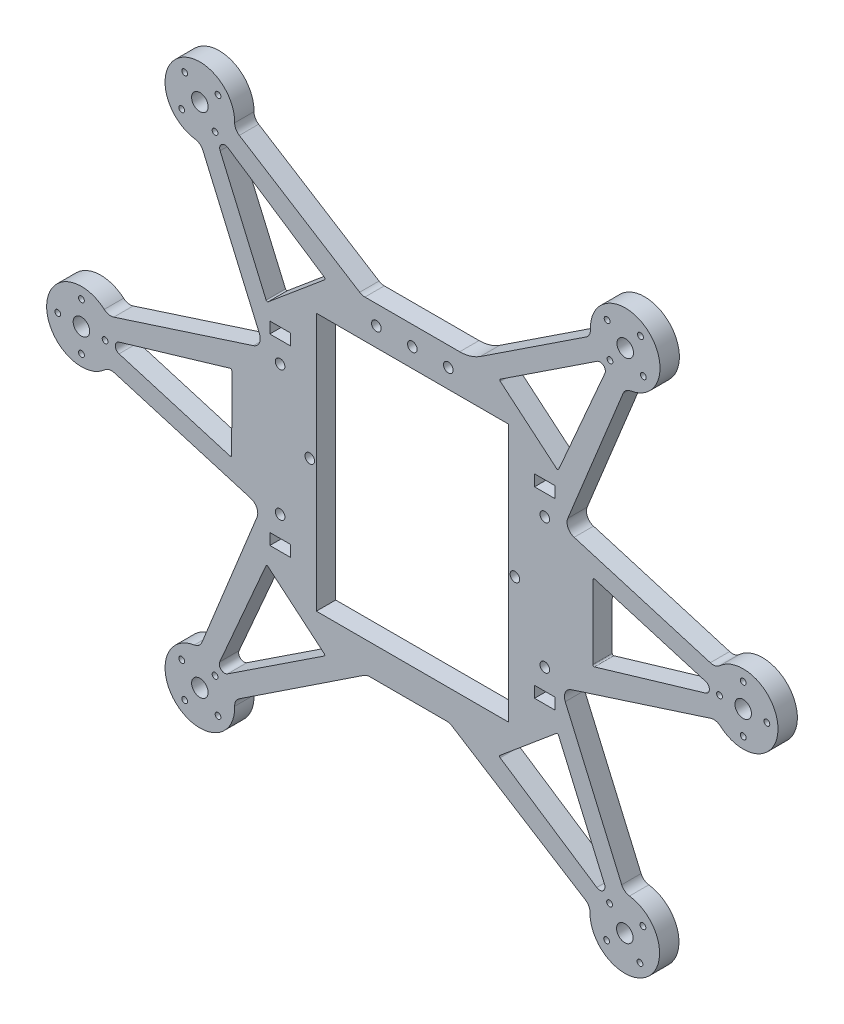
from build123d import *

# Parameters (mm, degrees)
SKETCH1_R           = 2.5
SKETCH1_R_2         = 0.875
SKETCH1_R_3         = 1.45
SKETCH1_R_4         = 1.450000004
SKETCH1_R_5         = 1.450000003
SKETCH1_W           = 6.2
SKETCH1_H           = 3.4
SKETCH1_W_2         = 58
SKETCH1_H_2         = 78
BOSS_EXTRUDE5_DEPTH = 5.85


with BuildPart() as part:
    # Sketch1 → Boss-Extrude5 (new body)
    with BuildSketch(Plane.XY):
        with BuildLine():
            Line((603.954941057, 476.522477238), (586.876874298, 515.94635583))
            ThreePointArc((586.876874298, 515.94635583), (585.936525014, 517.144467375), (584.529018435, 517.726406616))
            ThreePointArc((584.529018435, 517.726406616), (579.097676306, 536.134868239), (596.468420789, 527.972260032))
            ThreePointArc((596.468420789, 527.972260032), (596.82997325, 526.492730421), (597.871467664, 525.381417037))
            Line((597.871467664, 525.381417037), (634.246279226, 502.517129354))
            ThreePointArc((634.246279226, 502.517129354), (635.012052507, 502.174352645), (635.842799888, 502.057035213))
            Line((635.842799888, 502.057035213), (664.477624236, 502.057035213))
            ThreePointArc((664.477624236, 502.057035213), (667.733181619, 502.535188201), (670.713759981, 503.929260211))
            Line((670.713759981, 503.929260211), (702.648845813, 525.004026215))
            ThreePointArc((702.648845813, 525.004026215), (703.665465412, 526.138139367), (703.994152736, 527.625315447))
            ThreePointArc((703.994152736, 527.625315447), (721.1798058, 536.1707391), (716.157604078, 517.646473216))
            ThreePointArc((716.157604078, 517.646473216), (714.763334773, 517.033495929), (713.849758343, 515.814846612))
            Line((713.849758343, 515.814846612), (697.147626147, 474.790192689))
            ThreePointArc((697.147626147, 474.790192689), (697.221465914, 472.361081432), (699.070208039, 470.783682824))
            Line((699.070208039, 470.783682824), (740.214490272, 458.53510182))
            ThreePointArc((740.214490272, 458.53510182), (741.736741832, 458.485319907), (743.087260943, 459.189469167))
            ThreePointArc((743.087260943, 459.189469167), (760.6801601, 451.51738758), (743.261540117, 443.457448713))
            ThreePointArc((743.261540117, 443.457448713), (741.895753238, 444.131506761), (740.374978091, 444.048014227))
            Line((740.374978091, 444.048014227), (698.212346292, 430.47245055))
            ThreePointArc((698.212346292, 430.47245055), (696.399002399, 428.854483388), (696.378993493, 426.424332476))
            Line((696.378993493, 426.424332476), (713.443070907, 387.0327476))
            ThreePointArc((713.443070907, 387.0327476), (714.383420191, 385.834636055), (715.79092677, 385.252696814))
            ThreePointArc((715.79092677, 385.252696814), (721.222268899, 366.844235191), (703.851524416, 375.006843398))
            ThreePointArc((703.851524416, 375.006843398), (703.489971954, 376.486373008), (702.448477541, 377.597686392))
            Line((702.448477541, 377.597686392), (662.116784523, 402.949169804))
            ThreePointArc((662.116784523, 402.949169804), (661.351028594, 403.291941512), (660.520299977, 403.409263945))
            Line((660.520299977, 403.409263945), (637.239098686, 403.409544222))
            ThreePointArc((637.239098686, 403.409544222), (636.373912642, 403.282089365), (635.582244311, 402.910534677))
            Line((635.582244311, 402.910534677), (597.801874827, 377.882367998))
            ThreePointArc((597.801874827, 377.882367998), (596.787260959, 376.746460102), (596.461202206, 375.258705506))
            ThreePointArc((596.461202206, 375.258705506), (579.290676989, 366.682925635), (584.280135784, 385.216037558))
            ThreePointArc((584.280135784, 385.216037558), (585.673319691, 385.831477766), (586.584741163, 387.051739604))
            Line((586.584741163, 387.051739604), (603.228036217, 428.139630454))
            ThreePointArc((603.228036217, 428.139630454), (603.150479211, 430.567413415), (601.300918772, 432.141983635))
            Line((601.300918772, 432.141983635), (560.112090621, 444.364217596))
            ThreePointArc((560.112090621, 444.364217596), (558.589795669, 444.412654468), (557.239899253, 443.7073122))
            ThreePointArc((557.239899253, 443.7073122), (539.640228116, 451.363846175), (557.051719751, 459.439172525))
            ThreePointArc((557.051719751, 459.439172525), (558.418101677, 458.766321513), (559.938802458, 458.851157731))
            Line((559.938802458, 458.851157731), (602.124111054, 472.475172686))
            ThreePointArc((602.124111054, 472.475172686), (603.935478665, 474.093533762), (603.954941057, 476.522477238))
        make_face()
        with Locations((550.160251098, 451.489683338)):
            Circle(SKETCH1_R, mode=Mode.SUBTRACT)
        with Locations((714.50687282, 528.036940234)):
            Circle(SKETCH1_R, mode=Mode.SUBTRACT)
        with Locations((585.949161838, 528.150892754)):
            Circle(SKETCH1_R, mode=Mode.SUBTRACT)
        with Locations((719.982944906, 523.433718795)):
            Circle(SKETCH1_R_2, mode=Mode.SUBTRACT)
        with Locations((681.160212062, 451.489683338)):
            Circle(SKETCH1_R_3, mode=Mode.SUBTRACT)
        with Locations((550.160251098, 458.643494428)):
            Circle(SKETCH1_R_2, mode=Mode.SUBTRACT)
        with Locations((619.160212062, 451.489683338)):
            Circle(SKETCH1_R_3, mode=Mode.SUBTRACT)
        with Locations((557.314062187, 451.489683338)):
            Circle(SKETCH1_R_2, mode=Mode.SUBTRACT)
        with Locations((709.903651381, 522.560868149)):
            Circle(SKETCH1_R_2, mode=Mode.SUBTRACT)
        with Locations((709.030800734, 532.640161674)):
            Circle(SKETCH1_R_2, mode=Mode.SUBTRACT)
        with Locations((661.029382116, 496.222272015)):
            Circle(SKETCH1_R_3, mode=Mode.SUBTRACT)
        with Locations((719.110094259, 533.51301232)):
            Circle(SKETCH1_R_2, mode=Mode.SUBTRACT)
        with Locations((750.160030038, 451.400845678)):
            Circle(SKETCH1_R, mode=Mode.SUBTRACT)
        with Locations((750.153709121, 444.247037381)):
            Circle(SKETCH1_R_2, mode=Mode.SUBTRACT)
        with Locations((591.433359939, 532.744429986)):
            Circle(SKETCH1_R_2, mode=Mode.SUBTRACT)
        with Locations((590.54269907, 522.666694653)):
            Circle(SKETCH1_R_2, mode=Mode.SUBTRACT)
        with Locations((610.198620139, 432.360721889)):
            Circle(SKETCH1_R_4, mode=Mode.SUBTRACT)
        with Locations((690.19862014, 471.710721889)):
            Circle(SKETCH1_R_5, mode=Mode.SUBTRACT)
        with Locations((580.464963737, 523.557355522)):
            Circle(SKETCH1_R_2, mode=Mode.SUBTRACT)
        with Locations((581.355624606, 533.635090855)):
            Circle(SKETCH1_R_2, mode=Mode.SUBTRACT)
        with Locations((550.160251098, 444.335872249)):
            Circle(SKETCH1_R_2, mode=Mode.SUBTRACT)
        with Locations((543.006440008, 451.489683338)):
            Circle(SKETCH1_R_2, mode=Mode.SUBTRACT)
        with Locations((743.006221741, 451.407166596)):
            Circle(SKETCH1_R_2, mode=Mode.SUBTRACT)
        with Locations((750.166350956, 458.554653975)):
            Circle(SKETCH1_R_2, mode=Mode.SUBTRACT)
        with Locations((639.291042009, 496.222272015)):
            Circle(SKETCH1_R_3, mode=Mode.SUBTRACT)
        with Locations((585.949225938, 374.828503848)):
            Circle(SKETCH1_R, mode=Mode.SUBTRACT)
        with Locations((580.465027837, 379.422041079)):
            Circle(SKETCH1_R_2, mode=Mode.SUBTRACT)
        with Locations((590.54276317, 380.312701948)):
            Circle(SKETCH1_R_2, mode=Mode.SUBTRACT)
        with Locations((591.433424039, 370.234966616)):
            Circle(SKETCH1_R_2, mode=Mode.SUBTRACT)
        with Locations((581.355688706, 369.344305747)):
            Circle(SKETCH1_R_2, mode=Mode.SUBTRACT)
        with Locations((757.313838335, 451.394524761)):
            Circle(SKETCH1_R_2, mode=Mode.SUBTRACT)
        with Locations((714.370783367, 374.828210676)):
            Circle(SKETCH1_R, mode=Mode.SUBTRACT)
        with Locations((708.886585266, 370.234673444)):
            Circle(SKETCH1_R_2, mode=Mode.SUBTRACT)
        with Locations((709.777246135, 380.312408776)):
            Circle(SKETCH1_R_2, mode=Mode.SUBTRACT)
        with Locations((719.854981468, 379.421747908)):
            Circle(SKETCH1_R_2, mode=Mode.SUBTRACT)
        with Locations((718.964320599, 369.344012575)):
            Circle(SKETCH1_R_2, mode=Mode.SUBTRACT)
        with Locations((650.160212062, 496.222272015)):
            Circle(SKETCH1_R_3, mode=Mode.SUBTRACT)
        with Locations((690.19862014, 432.360721889)):
            Circle(SKETCH1_R_5, mode=Mode.SUBTRACT)
        with Locations((610.19862014, 471.710721889)):
            Circle(SKETCH1_R_5, mode=Mode.SUBTRACT)
        with BuildLine():
            Line((595.577566899, 440.419173584), (595.601110518, 462.65662788))
            ThreePointArc((595.601110518, 462.65662788), (595.442012438, 462.974679214), (595.091955881, 463.037363))
            Line((595.091955881, 463.037363), (561.522312862, 453.103823563))
            ThreePointArc((561.522312862, 453.103823563), (560.374825077, 451.568917465), (561.519786474, 450.03212589))
            Line((561.519786474, 450.03212589), (595.073043959, 440.043379703))
            ThreePointArc((595.073043959, 440.043379703), (595.419517744, 440.104791682), (595.577566899, 440.419173584))
        make_face(mode=Mode.SUBTRACT)
        with BuildLine():
            Line((623.555666528, 402.560964817), (606.535921781, 416.872960368))
            ThreePointArc((606.535921781, 416.872960368), (606.19001405, 416.955523625), (605.916983466, 416.727657106))
            Line((605.916983466, 416.727657106), (591.948365558, 384.626662543))
            ThreePointArc((591.948365558, 384.626662543), (592.386580915, 382.76101728), (594.299798561, 382.650278013))
            Line((594.299798561, 382.650278013), (623.519240247, 401.932922172))
            ThreePointArc((623.519240247, 401.932922172), (623.694904998, 402.237811349), (623.555666528, 402.560964817))
        make_face(mode=Mode.SUBTRACT)
        with Locations((610.19862014, 424.360721889)):
            Rectangle(SKETCH1_W, SKETCH1_H, mode=Mode.SUBTRACT)
        with BuildLine():
            Line((706.020625564, 520.329088664), (676.801183878, 501.046444505))
            ThreePointArc((676.801183878, 501.046444505), (676.625519127, 500.741555328), (676.764757597, 500.41840186))
            Line((676.764757597, 500.41840186), (693.784502344, 486.106406309))
            ThreePointArc((693.784502344, 486.106406309), (694.130410075, 486.023843052), (694.403440659, 486.251709571))
            Line((694.403440659, 486.251709571), (708.372058567, 518.352704134))
            ThreePointArc((708.372058567, 518.352704134), (707.93384321, 520.218349397), (706.020625564, 520.329088664))
        make_face(mode=Mode.SUBTRACT)
        with BuildLine():
            Line((592.066690993, 518.455288928), (605.982485658, 486.331360198))
            ThreePointArc((605.982485658, 486.331360198), (606.25223902, 486.105420739), (606.594661568, 486.186428853))
            Line((606.594661568, 486.186428853), (623.644673407, 500.462353488))
            ThreePointArc((623.644673407, 500.462353488), (623.786048589, 500.788669145), (623.609055138, 501.097120386))
            Line((623.609055138, 501.097120386), (594.421371857, 520.427802808))
            ThreePointArc((594.421371857, 520.427802808), (592.50797464, 520.320210827), (592.066690993, 518.455288928))
        make_face(mode=Mode.SUBTRACT)
        with Locations((650.160212062, 451.489683338)):
            Rectangle(SKETCH1_W_2, SKETCH1_H_2, mode=Mode.SUBTRACT)
        with BuildLine():
            Line((738.800618585, 452.947176745), (705.247361101, 462.935922932))
            ThreePointArc((705.247361101, 462.935922932), (704.900887315, 462.874510953), (704.74283816, 462.560129051))
            Line((704.74283816, 462.560129051), (704.719294542, 440.322674755))
            ThreePointArc((704.719294542, 440.322674755), (704.878392622, 440.004623421), (705.228449179, 439.941939634))
            Line((705.228449179, 439.941939634), (738.798092198, 449.875479072))
            ThreePointArc((738.798092198, 449.875479072), (739.945579983, 451.41038517), (738.800618585, 452.947176745))
        make_face(mode=Mode.SUBTRACT)
        with BuildLine():
            Line((708.253652752, 384.523987147), (694.337858087, 416.647915876))
            ThreePointArc((694.337858087, 416.647915876), (694.068104725, 416.873855335), (693.725682178, 416.792847221))
            Line((693.725682178, 416.792847221), (676.675670339, 402.516922586))
            ThreePointArc((676.675670339, 402.516922586), (676.534295157, 402.19060693), (676.711288608, 401.882155688))
            Line((676.711288608, 401.882155688), (705.898971889, 382.551473267))
            ThreePointArc((705.898971889, 382.551473267), (707.812369106, 382.659065248), (708.253652752, 384.523987147))
        make_face(mode=Mode.SUBTRACT)
        with Locations((690.19862014, 479.710721889)):
            Rectangle(SKETCH1_W, SKETCH1_H, mode=Mode.SUBTRACT)
        with Locations((690.19862014, 424.360721889)):
            Rectangle(SKETCH1_W, SKETCH1_H, mode=Mode.SUBTRACT)
        with Locations((610.19862014, 479.710721889)):
            Rectangle(SKETCH1_W, SKETCH1_H, mode=Mode.SUBTRACT)
    extrude(amount=BOSS_EXTRUDE5_DEPTH)


solid = part.part
